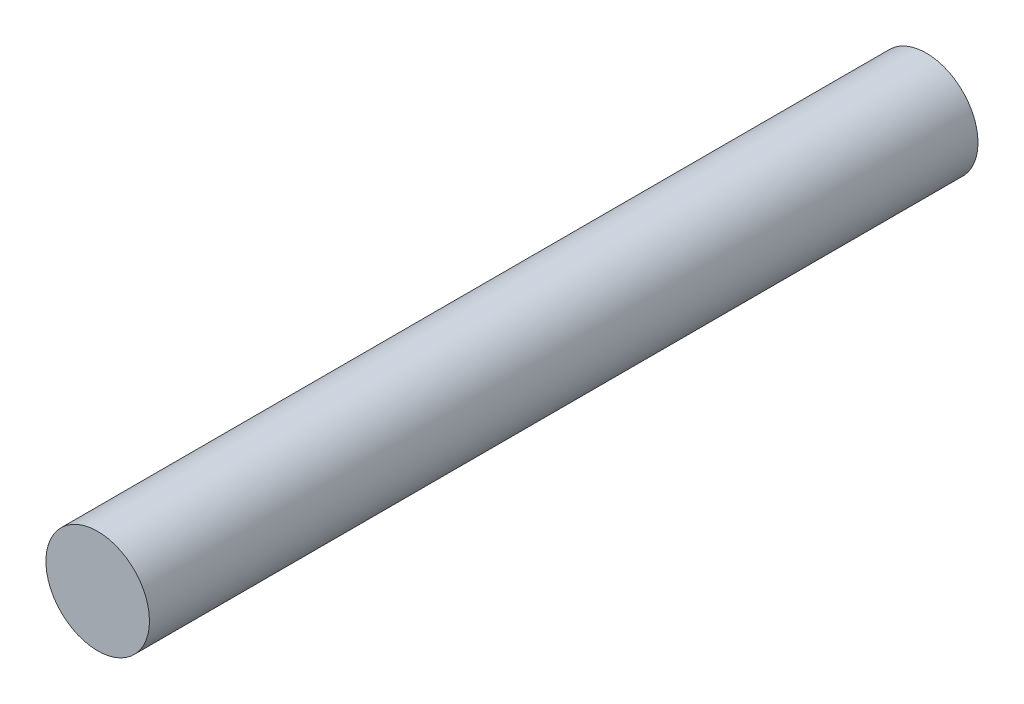
from build123d import *

# Parameters (mm, degrees)
SKETCH1_R           = 3.175
BOSS_EXTRUDE1_DEPTH = 50.8


with BuildPart() as part:
    # Sketch1 → Boss-Extrude1 (new body)
    with BuildSketch(Plane.XY):
        with Locations((-5.146673194, 5.633520658)):
            Circle(SKETCH1_R)
    extrude(amount=BOSS_EXTRUDE1_DEPTH)


solid = part.part
